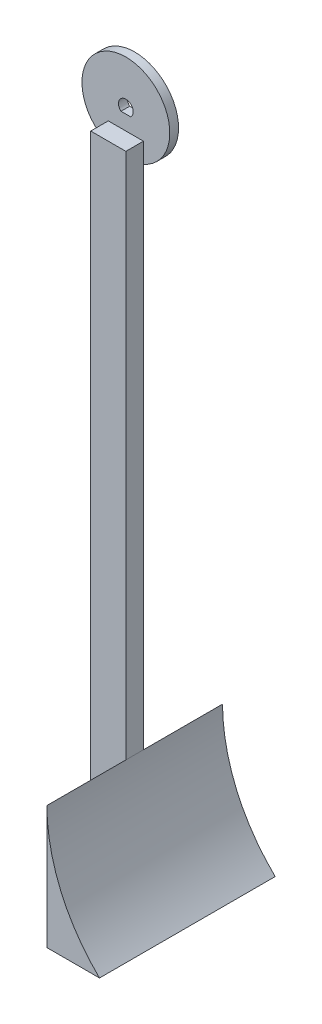
from build123d import *

# Parameters (mm, degrees)
SKETCH2_R           = 12.5
BOSS_EXTRUDE1_DEPTH = 2.5
BOSS_EXTRUDE2_DEPTH = 5
BOSS_EXTRUDE3_DEPTH = 15
SKETCH9_W           = 5
SKETCH9_H           = 25
BOSS_EXTRUDE4_DEPTH = 10
CUT_EXTRUDE1_DEPTH  = 142


with BuildPart() as part:
    # Sketch2 → Boss-Extrude1 (new body)
    with BuildSketch(Plane.XY):
        Circle(SKETCH2_R)
        with BuildLine():
            ThreePointArc((1.389019438, -1.575), (0, 2.1), (-1.389019438, -1.575))
            Line((-1.389019438, -1.575), (0, -1.575))
            Line((0, -1.575), (1.389019438, -1.575))
        make_face(mode=Mode.SUBTRACT)
    extrude(amount=BOSS_EXTRUDE1_DEPTH)

    # Sketch4 → Boss-Extrude2 (add)
    with BuildSketch(Plane.XY.offset(2.5)):
        Polygon((-5, -165.75443039), (5, -165.75443039), (5, -5.75443039), (0, -5.75443039), (-5, -5.75443039), align=None)
    extrude(amount=BOSS_EXTRUDE2_DEPTH)

    # Sketch5 → Boss-Extrude3 (add)
    with BuildSketch(Plane(origin=(5, 0, 0), x_dir=(0, 0, -1), z_dir=(1, 0, 0))):
        Polygon((20, -155.75443039), (-5, -155.75443039), (-30, -155.75443039), (-30, -190.75443039), (-5, -190.75443039), (20, -190.75443039), align=None)
    extrude(amount=BOSS_EXTRUDE3_DEPTH)

    # Sketch9 → Boss-Extrude4 (add)
    with BuildSketch(Plane.ZY.offset(5)):
        with Locations((5, -178.25443039)):
            Rectangle(SKETCH9_W, SKETCH9_H)
    extrude(amount=-BOSS_EXTRUDE4_DEPTH)

    # Sketch6 → Cut-Extrude1 (cut)
    with BuildSketch(Plane(origin=(0, 0, -20), x_dir=(-1, 0, 0), z_dir=(0, 0, -1))):
        with BuildLine():
            Line((-5, -155.75443039), (-20, -155.75443039))
            Line((-20, -155.75443039), (-20, -190.75443039))
            ThreePointArc((-20, -190.75443039), (-8.963631912, -174.770016714), (-5, -155.75443039))
        make_face()
    extrude(amount=-CUT_EXTRUDE1_DEPTH, mode=Mode.SUBTRACT)


solid = part.part
